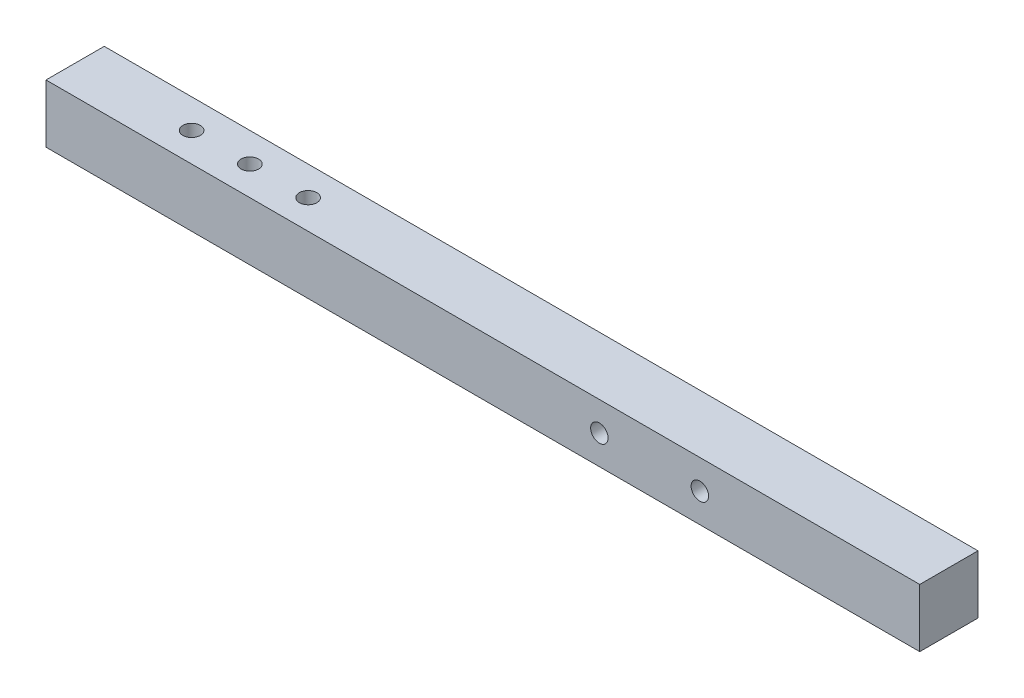
from build123d import *

# Parameters (mm, degrees)
SKIZZE1_W                       = 20
SKIZZE1_H                       = 20
AUFSATZ_LINEAR_AUSTRAGEN1_DEPTH = 300
SKIZZE2_R                       = 3
SCHNITT_LINEAR_AUSTRAGEN1_DEPTH = 301.83217913
SKETCH1_R                       = 3
EXTRUDE1_DEPTH                  = 301.83217913


with BuildPart() as part:
    # Skizze1 → Aufsatz-Linear austragen1 (new body)
    with BuildSketch(Plane(origin=(0, 0, 0), x_dir=(0, 0, -1), z_dir=(1, 0, 0))):
        Rectangle(SKIZZE1_W, SKIZZE1_H)
    extrude(amount=AUFSATZ_LINEAR_AUSTRAGEN1_DEPTH)

    # Skizze2 → Schnitt-Linear austragen1 (cut, through all)
    with BuildSketch(Plane(origin=(0, 10, 0), x_dir=(1, 0, 0), z_dir=(0, 1, 0))):
        with Locations(Location((40, 0, 0), (0, 0, 270))):
            Circle(SKIZZE2_R)
        with Locations(Location((60, 0, 0), (0, 0, 270))):
            Circle(SKIZZE2_R)
        with Locations(Location((80, 0, 0), (0, 0, 270))):
            Circle(SKIZZE2_R)
    extrude(amount=-SCHNITT_LINEAR_AUSTRAGEN1_DEPTH, mode=Mode.SUBTRACT)

    # Sketch1 → Extrude1 (cut, through all)
    with BuildSketch(Plane.XY.offset(10)):
        with Locations((190, 0)):
            Circle(SKETCH1_R)
        with Locations((224.5, 0)):
            Circle(SKETCH1_R)
    extrude(amount=-EXTRUDE1_DEPTH, mode=Mode.SUBTRACT)


solid = part.part
